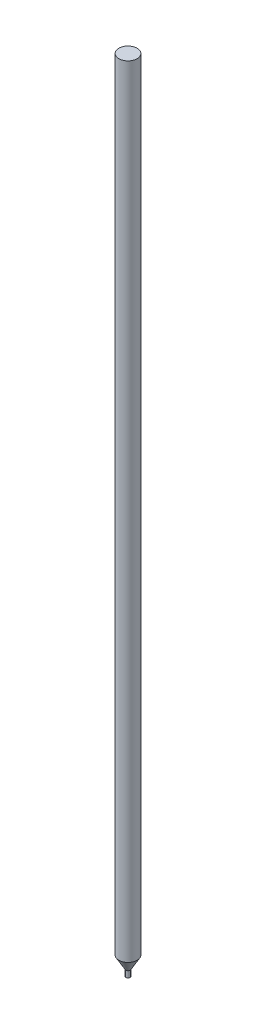
from build123d import *

# Parameters (mm, degrees)
SKETCH1_R           = 0.875
BOSS_EXTRUDE1_DEPTH = 75


with BuildPart() as part:
    # Sketch1 → Boss-Extrude1 (new body)
    with BuildSketch(Plane(origin=(0, 0, 0), x_dir=(1, 0, 0), z_dir=(0, 1, 0))):
        with Locations(Location((0, 0, 0), (0, 0, 270))):
            Circle(SKETCH1_R)
    extrude(amount=BOSS_EXTRUDE1_DEPTH)

    # Sketch2 → Revolve1 (revolve)
    with BuildSketch(Plane(origin=(0, 0, 0), x_dir=(0, 0, -1), z_dir=(1, 0, 0)), mode=Mode.PRIVATE) as revolve1_sk:
        Polygon((0, 0), (0, -1.769134295), (0.2, -1.769134295), (0.2, -1.169134295), (0.875, 0), align=None)
    revolve(revolve1_sk.sketch.rotate(Axis((0, 0, 0), (0, -1, 0)), 180), axis=Axis((0, 0, 0), (0, -1, 0)))


solid = part.part
